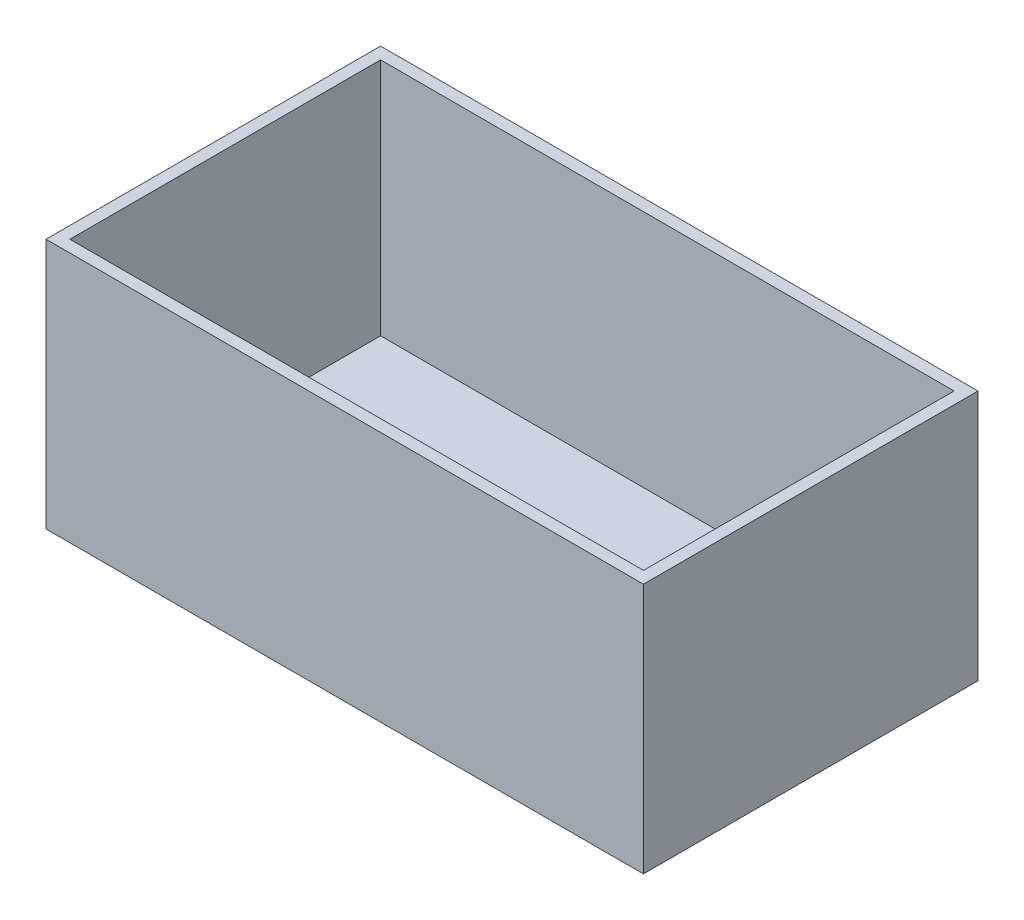
from build123d import *

# Parameters (mm, degrees)
SKETCH1_W           = 150
SKETCH1_H           = 84
BOSS_EXTRUDE1_DEPTH = 63
SHELL1_T            = -3


with BuildPart() as part:
    # Sketch1 → Boss-Extrude1 (new body)
    with BuildSketch(Plane(origin=(0, 0, 0), x_dir=(1, 0, 0), z_dir=(0, 1, 0))):
        with Locations((-10.344827586, 2.773706897)):
            Rectangle(SKETCH1_W, SKETCH1_H)
    extrude(amount=-BOSS_EXTRUDE1_DEPTH)

    # Shell1
    shell1_openings = [part.faces().sort_by_distance(p)[0] for p in [
        (-10.344827586, 0, -2.773706897),
    ]]
    offset(amount=SHELL1_T, openings=shell1_openings, kind=Kind.INTERSECTION)


solid = part.part
